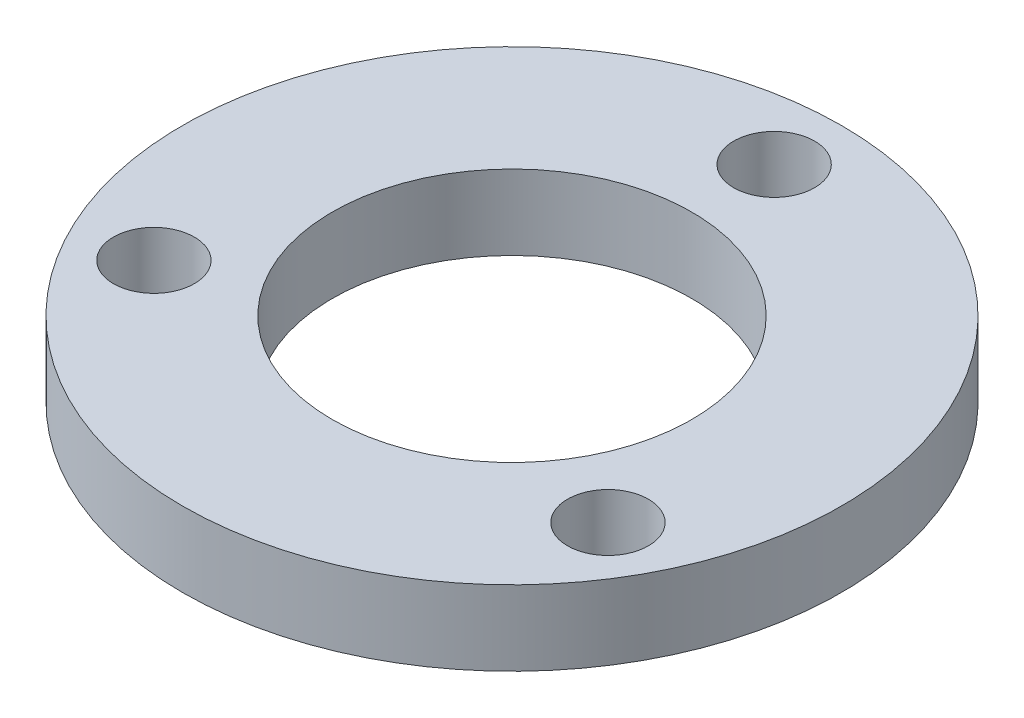
from build123d import *

# Parameters (mm, degrees)
SKETCH_1_R               = 22
SKETCH_1_R_2             = 12
EXTRUDE_1_DEPTH          = 5
SKETCH_1_3_R             = 2.7
CUT_EXTRUDE_1_DEPTH      = 32.511902513
PATTERN_CIRCULAR_1_COUNT = 3


with BuildPart() as part:
    # 草图1 → 凸台-拉伸1 (new body)
    with BuildSketch(Plane(origin=(0, 0, 0), x_dir=(1, 0, 0), z_dir=(0, 1, 0))):
        Circle(SKETCH_1_R)
        Circle(SKETCH_1_R_2, mode=Mode.SUBTRACT)
    extrude(amount=EXTRUDE_1_DEPTH)

    # 草图1<3> → 切除-拉伸1 (cut, symmetric)
    with BuildSketch(Plane(origin=(0, 0, 0), x_dir=(1, 0, 0), z_dir=(0, 1, 0))):
        with Locations((0, 17.5)):
            Circle(SKETCH_1_3_R)
    cut_extrude_1 = extrude(amount=CUT_EXTRUDE_1_DEPTH, both=True, mode=Mode.SUBTRACT)

    # 阵列(圆周)1: 切除-拉伸1 ×3 about axis
    pattern_circular_1_axis = Axis((0, 5, 0), (0, -1, 0))
    for i in range(1, PATTERN_CIRCULAR_1_COUNT):
        add(cut_extrude_1.rotate(pattern_circular_1_axis, i * 360 / PATTERN_CIRCULAR_1_COUNT), mode=Mode.SUBTRACT)


solid = part.part
